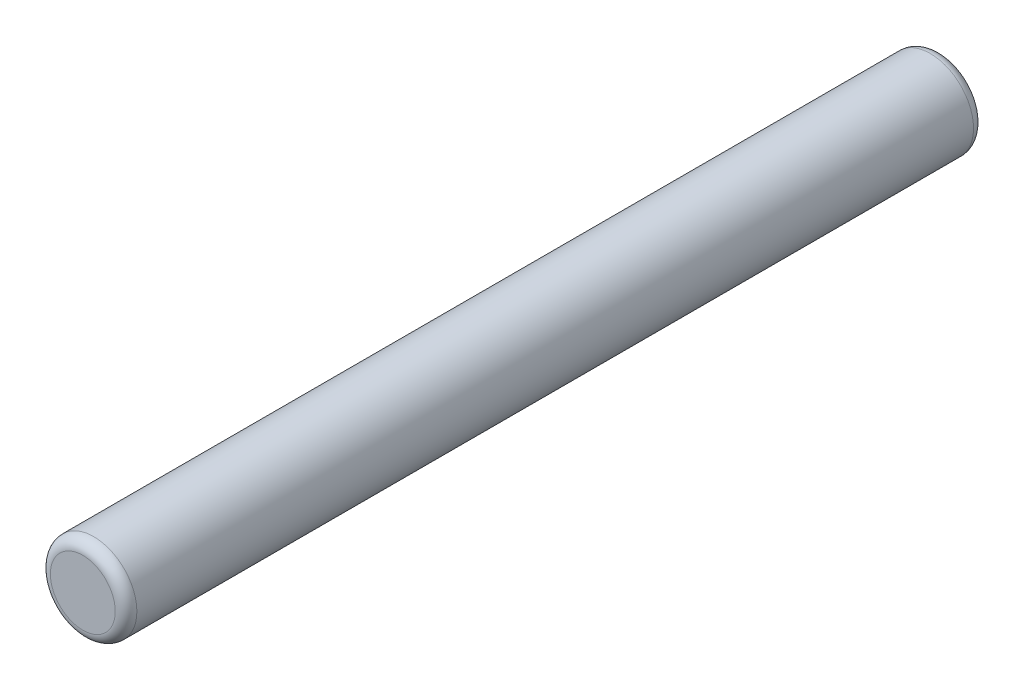
from build123d import *

# Parameters (mm, degrees)
ESQUISSE1_R          = 2
BASE_EXTRUSION_DEPTH = 19.85
CONG_1_R             = 0.5


with BuildPart() as part:
    # Esquisse1 → Base-Extrusion (new, symmetric)
    with BuildSketch(Plane.XY):
        Circle(ESQUISSE1_R)
    extrude(amount=BASE_EXTRUSION_DEPTH, both=True)

    # Congé1
    cong_1_edges = [part.edges().sort_by_distance(p)[0] for p in [
        (-2, 0, -19.85),
        (-2, 0, 19.85),
    ]]
    fillet(cong_1_edges, radius=CONG_1_R)


solid = part.part
